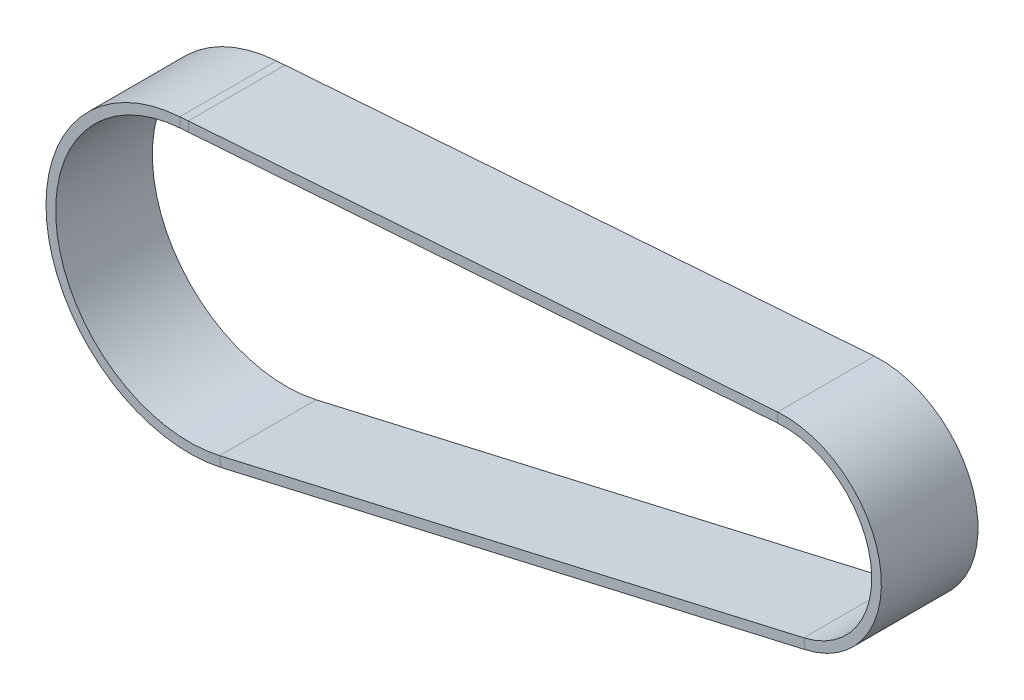
from build123d import *

# Parameters (mm, degrees)
CROQUIS3_W = 10
CROQUIS3_H = 1


with BuildPart() as part:
    # Barrer1: sweep along a path in Croquis2
    with BuildLine(Plane.XY) as barrer1_path:
        Line((-0.881462424, 11.628685909), (60.950592116, 16.106156228))
        ThreePointArc((60.950592116, 16.106156228), (70.638624048, 8.356778461), (63.656135399, -1.897765446))
        Line((63.656135399, -1.897765446), (3.239082958, -15.79130652))
        ThreePointArc((3.239082958, -15.79130652), (-13.62778781, -4.306375082), (-0.881462424, 11.628685909))
    # Croquis3 → Barrer1 (sweep)
    with BuildSketch(Plane(origin=(0, 0, 0), x_dir=(0, 0, -1), z_dir=(1, 0, 0))):
        with Locations((0, 12.128685909)):
            Rectangle(CROQUIS3_W, CROQUIS3_H)
    sweep(path=barrer1_path.line)


solid = part.part
